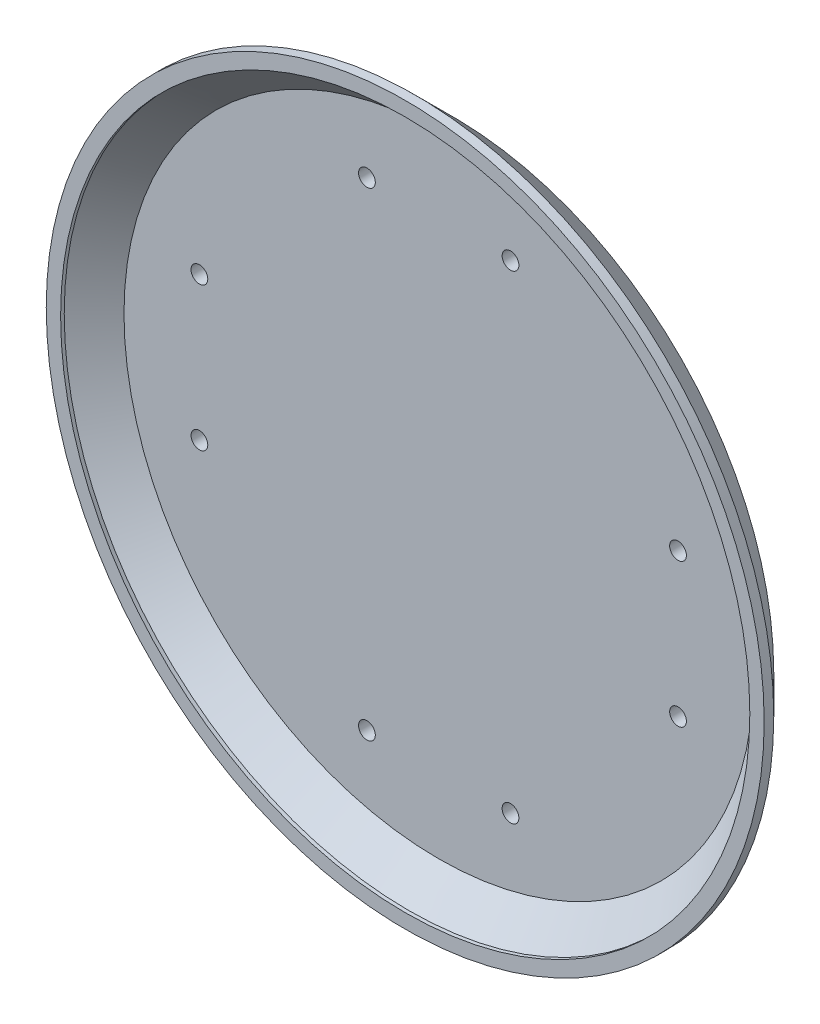
from build123d import *

# Parameters (mm, degrees)
SKETCH1_R           = 75
BOSS_EXTRUDE1_DEPTH = 10
CHAMFER1_SIZE       = 8
SHELL1_T            = -3
SKETCH2_R           = 1.75
CUT_EXTRUDE1_DEPTH  = 107.536378763


with BuildPart() as part:
    # Sketch1 → Boss-Extrude1 (new body)
    with BuildSketch(Plane.XY):
        Circle(SKETCH1_R)
    extrude(amount=BOSS_EXTRUDE1_DEPTH)

    # Chamfer1
    chamfer1_edges = [part.edges().sort_by_distance(p)[0] for p in [
        (-75, 0, 0),
    ]]
    chamfer(chamfer1_edges, length=CHAMFER1_SIZE)

    # Shell1
    shell1_openings = [part.faces().sort_by_distance(p)[0] for p in [
        (0, 0, 10),
    ]]
    offset(amount=SHELL1_T, openings=shell1_openings, kind=Kind.INTERSECTION)

    # Sketch2 → Cut-Extrude1 (cut, through all)
    with BuildSketch(Plane(origin=(0, 0, 0), x_dir=(-1, 0, 0), z_dir=(0, 0, -1))):
        with Locations((-50, 15)):
            Circle(SKETCH2_R)
        with Locations((-50, -15)):
            Circle(SKETCH2_R)
        with Locations((-15, -50)):
            Circle(SKETCH2_R)
        with Locations((15, -50)):
            Circle(SKETCH2_R)
        with Locations((50, -15)):
            Circle(SKETCH2_R)
        with Locations((50, 15)):
            Circle(SKETCH2_R)
        with Locations((-15, 50)):
            Circle(SKETCH2_R)
        with Locations((15, 50)):
            Circle(SKETCH2_R)
    extrude(amount=-CUT_EXTRUDE1_DEPTH, mode=Mode.SUBTRACT)


solid = part.part
